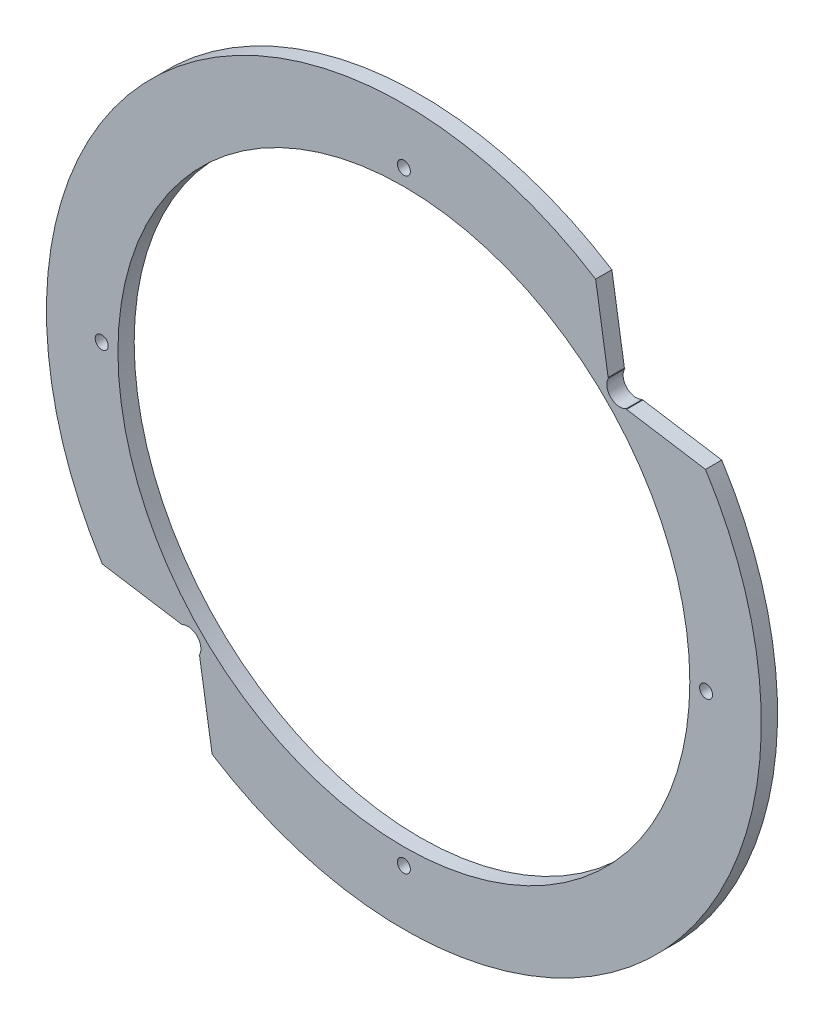
from build123d import *

# Parameters (mm, degrees)
SKETCH1_R           = 69.85
SKETCH1_R_2         = 55.88
BOSS_EXTRUDE1_DEPTH = 3.175
SKETCH4_R           = 1.27
CUT_EXTRUDE2_DEPTH  = 108.317012813


with BuildPart() as part:
    # Sketch1 → Boss-Extrude1 (new body)
    with BuildSketch(Plane.XY):
        with Locations((-8.548720341, -3.365444156)):
            Circle(SKETCH1_R)
        with Locations((-8.548720341, -3.365444156)):
            Circle(SKETCH1_R_2, mode=Mode.SUBTRACT)
    extrude(amount=BOSS_EXTRUDE1_DEPTH)

    # Sketch4 → Cut-Extrude2 (cut, through all)
    with BuildSketch(Plane(origin=(0, 0, 0), x_dir=(-1, 0, 0), z_dir=(0, 0, -1))):
        with BuildLine():
            ThreePointArc((-28.926835269, 55.58033798), (-40.842688325, 46.02596451), (-50.397061795, 34.110111454))
            Line((-50.397061795, 34.110111454), (-34.971216033, 36.553325402))
            ThreePointArc((-34.971216033, 36.553325402), (-34.937133041, 36.590451286), (-34.903018379, 36.62754807))
            ThreePointArc((-34.903018379, 36.62754807), (-31.862432204, 37.045708389), (-31.444271885, 40.086294564))
            ThreePointArc((-31.444271885, 40.086294564), (-31.407175101, 40.120409226), (-31.370049217, 40.154492217))
            Line((-31.370049217, 40.154492217), (-28.926835269, 55.58033798))
        make_face()
        with BuildLine():
            ThreePointArc((46.024275952, -62.311226293), (57.940129007, -52.756852822), (67.494502478, -40.840999767))
            Line((67.494502478, -40.840999767), (52.068656715, -43.284213714))
            ThreePointArc((52.068656715, -43.284213714), (52.034573724, -43.321339599), (52.000459061, -43.358436383))
            ThreePointArc((52.000459061, -43.358436383), (48.959872886, -43.776596701), (48.541712568, -46.817182876))
            ThreePointArc((48.541712568, -46.817182876), (48.504615784, -46.851297539), (48.467489899, -46.88538053))
            Line((48.467489899, -46.88538053), (46.024275952, -62.311226293))
        make_face()
        with Locations((-50.506279659, -3.365444156)):
            Circle(SKETCH4_R)
        with Locations((8.548720341, -62.420444156)):
            Circle(SKETCH4_R)
        with Locations((8.548720341, 55.689555844)):
            Circle(SKETCH4_R)
        with Locations((67.603720341, -3.365444156)):
            Circle(SKETCH4_R)
    extrude(amount=-CUT_EXTRUDE2_DEPTH, mode=Mode.SUBTRACT)


solid = part.part
